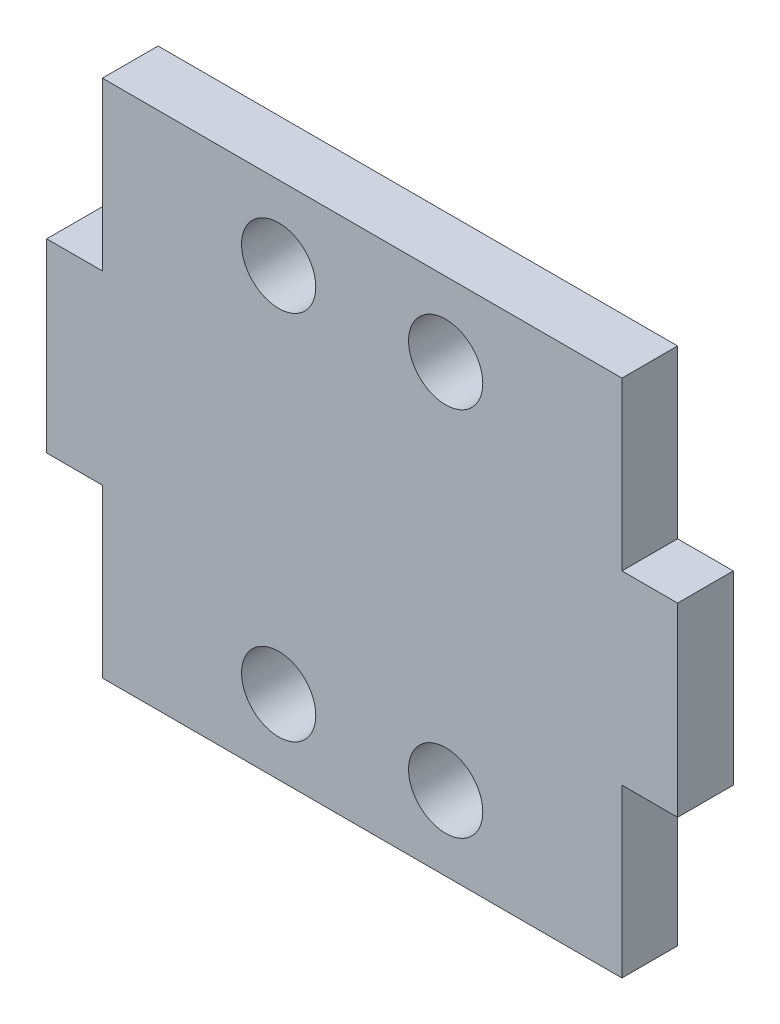
from build123d import *

# Parameters (mm, degrees)
SKETCH1_R           = 2
BOSS_EXTRUDE1_DEPTH = 3


with BuildPart() as part:
    # Sketch1 → Boss-Extrude1 (new body)
    with BuildSketch(Plane.XY):
        Polygon((-14, -14), (14, -14), (14, -5), (17, -5), (17, 5), (14, 5), (14, 14), (-14, 14), (-14, 5), (-17, 5), (-17, -5), (-14, -5), align=None)
        with Locations((-4.5, 10)):
            Circle(SKETCH1_R, mode=Mode.SUBTRACT)
        with Locations((4.5, 10)):
            Circle(SKETCH1_R, mode=Mode.SUBTRACT)
        with Locations((-4.5, -10)):
            Circle(SKETCH1_R, mode=Mode.SUBTRACT)
        with Locations((4.5, -10)):
            Circle(SKETCH1_R, mode=Mode.SUBTRACT)
    extrude(amount=BOSS_EXTRUDE1_DEPTH)


solid = part.part
